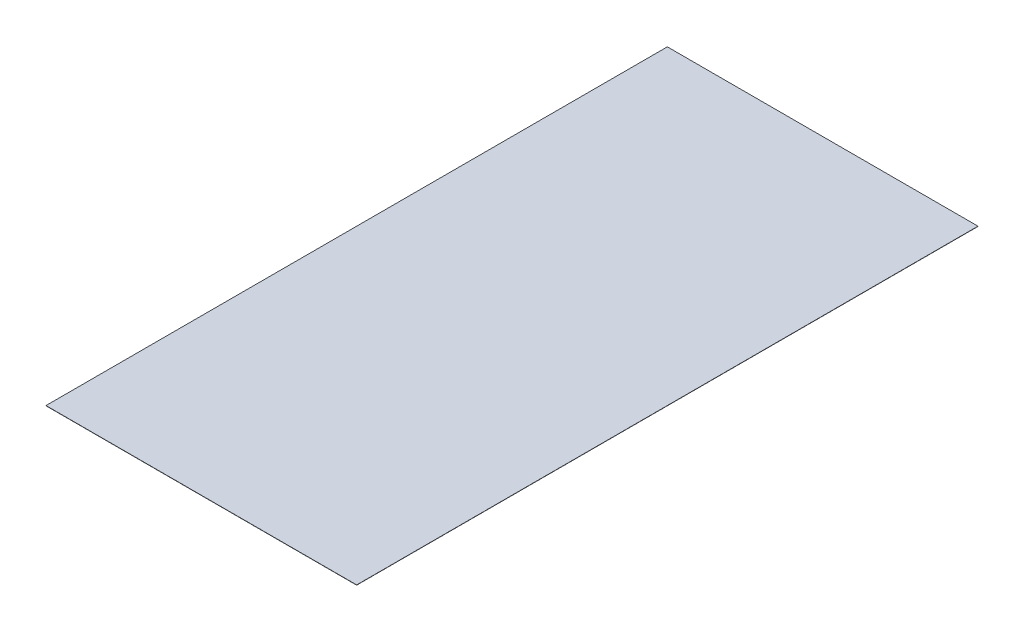
from build123d import *

# Parameters (mm, degrees)
SKETCH1_W           = 1219.2
SKETCH1_H           = 2438.4
BOSS_EXTRUDE1_DEPTH = 0.912


with BuildPart() as part:
    # Sketch1 → Boss-Extrude1 (new body)
    with BuildSketch(Plane(origin=(0, 0, 0), x_dir=(1, 0, 0), z_dir=(0, 1, 0))):
        Rectangle(SKETCH1_W, SKETCH1_H)
    extrude(amount=BOSS_EXTRUDE1_DEPTH)


solid = part.part
